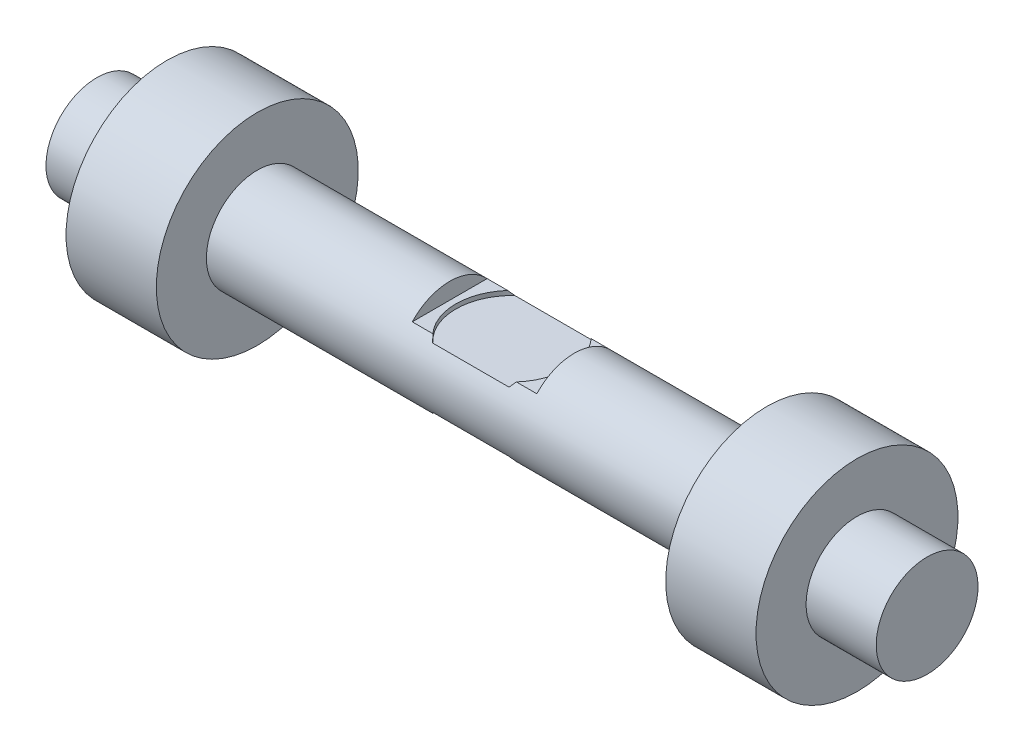
from build123d import *

# Parameters (mm, degrees)
SKETCH2_W          = 277.551020408
SKETCH2_H          = 73.171214091
CUT_EXTRUDE1_DEPTH = 1896.296810529
SKETCH3_R          = 125
CUT_EXTRUDE2_DEPTH = 10


with BuildPart() as part:
    # Sketch1 → Revolve1 (revolve)
    with BuildSketch(Plane.XY, mode=Mode.PRIVATE) as revolve1_sk:
        Polygon((0, 0), (0, 113.414392954), (156.301438496, 113.414392954), (156.301438496, 225), (357.44745317, 225), (357.44745317, 113.414392954), (1492.55254683, 113.414392954), (1492.55254683, 225), (1693.698561504, 225), (1693.698561504, 113.414392954), (1850, 113.414392954), (1850, 0), align=None)
    revolve(revolve1_sk.sketch.rotate(Axis((0, 0, 0), (1, 0, 0)), 180), axis=Axis((0, 0, 0), (1, 0, 0)))

    # Sketch2 → Cut-Extrude1 (cut, through all)
    with BuildSketch(Plane.XY.offset(120)):
        with Locations((925, 113.414392955)):
            Rectangle(SKETCH2_W, SKETCH2_H)
        with Locations((925, -113.414392955)):
            Rectangle(SKETCH2_W, SKETCH2_H)
    extrude(amount=-CUT_EXTRUDE1_DEPTH, mode=Mode.SUBTRACT)

    # Sketch3 → Cut-Extrude2 (cut)
    with BuildSketch(Plane(origin=(0, 76.828785909, 0), x_dir=(1, 0, 0), z_dir=(0, 1, 0))):
        with Locations((925, 0)):
            Circle(SKETCH3_R)
    cut_extrude2 = extrude(amount=-CUT_EXTRUDE2_DEPTH, mode=Mode.SUBTRACT)

    # Mirror1: Cut-Extrude2 across plane
    add(cut_extrude2.mirror(Plane.ZX), mode=Mode.SUBTRACT)


solid = part.part
